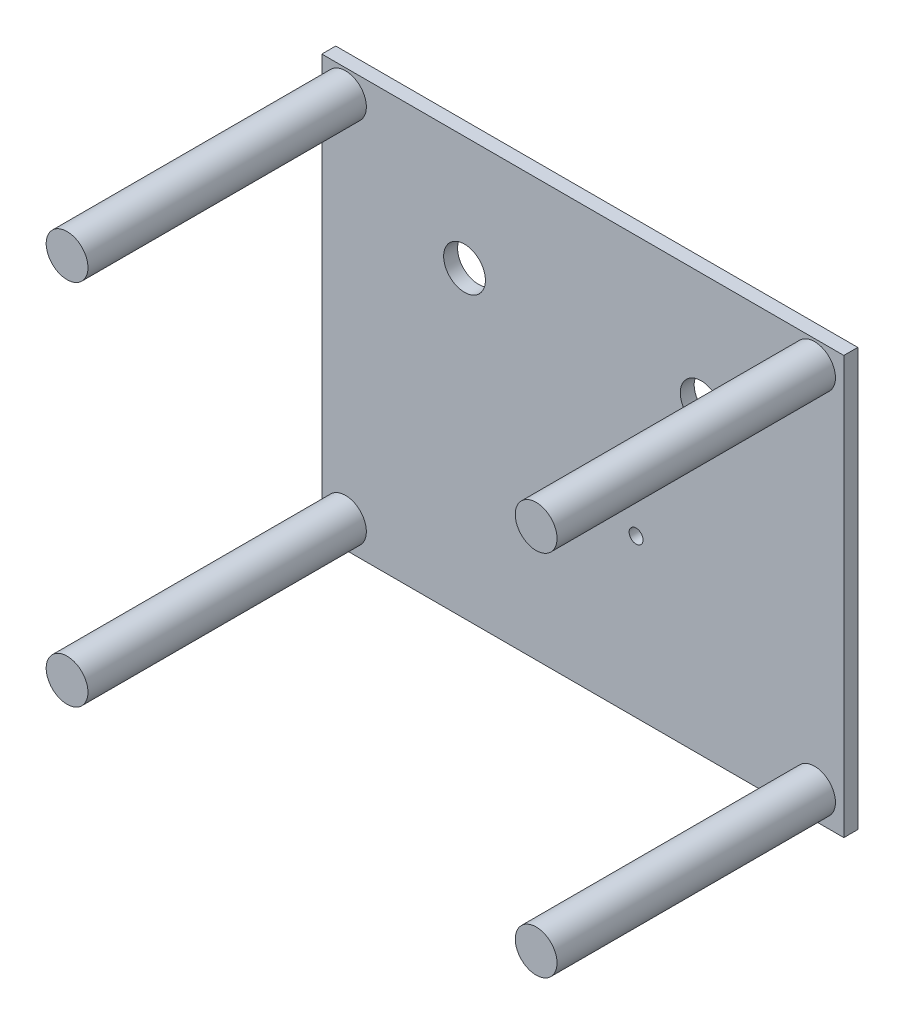
from build123d import *

# Parameters (mm, degrees)
ESQUISSE3_W             = 75
ESQUISSE3_H             = 60
BOSS_EXTRU_4_DEPTH      = 2
ESQUISSE7_R             = 3
ESQUISSE7_R_2           = 1
ENL_V_MAT_EXTRU_1_DEPTH = 2
ESQUISSE9_R             = 3
BOSS_EXTRU_5_DEPTH      = 40


with BuildPart() as part:
    # Esquisse3 → Boss.-Extru.4 (new body)
    with BuildSketch(Plane.XY):
        Rectangle(ESQUISSE3_W, ESQUISSE3_H)
    extrude(amount=BOSS_EXTRU_4_DEPTH)

    # Esquisse7 → Enlèv. mat.-Extru.1 (cut)
    with BuildSketch(Plane.XY.offset(2)):
        with Locations((-17, 13.6)):
            Circle(ESQUISSE7_R)
        with Locations((17, 13.6)):
            Circle(ESQUISSE7_R)
        with Locations((7.649218941, -7.4)):
            Circle(ESQUISSE7_R_2)
    extrude(amount=-ENL_V_MAT_EXTRU_1_DEPTH, mode=Mode.SUBTRACT)

    # Esquisse9 → Boss.-Extru.5 (add)
    with BuildSketch(Plane.XY.offset(2)):
        with Locations((-34.10132307, 26.617640071)):
            Circle(ESQUISSE9_R)
        with Locations((33.292276259, 26.617640071)):
            Circle(ESQUISSE9_R)
        with Locations((33.292276259, -26.213116666)):
            Circle(ESQUISSE9_R)
        with Locations((-34.10132307, -26.213116666)):
            Circle(ESQUISSE9_R)
    extrude(amount=BOSS_EXTRU_5_DEPTH)


solid = part.part
